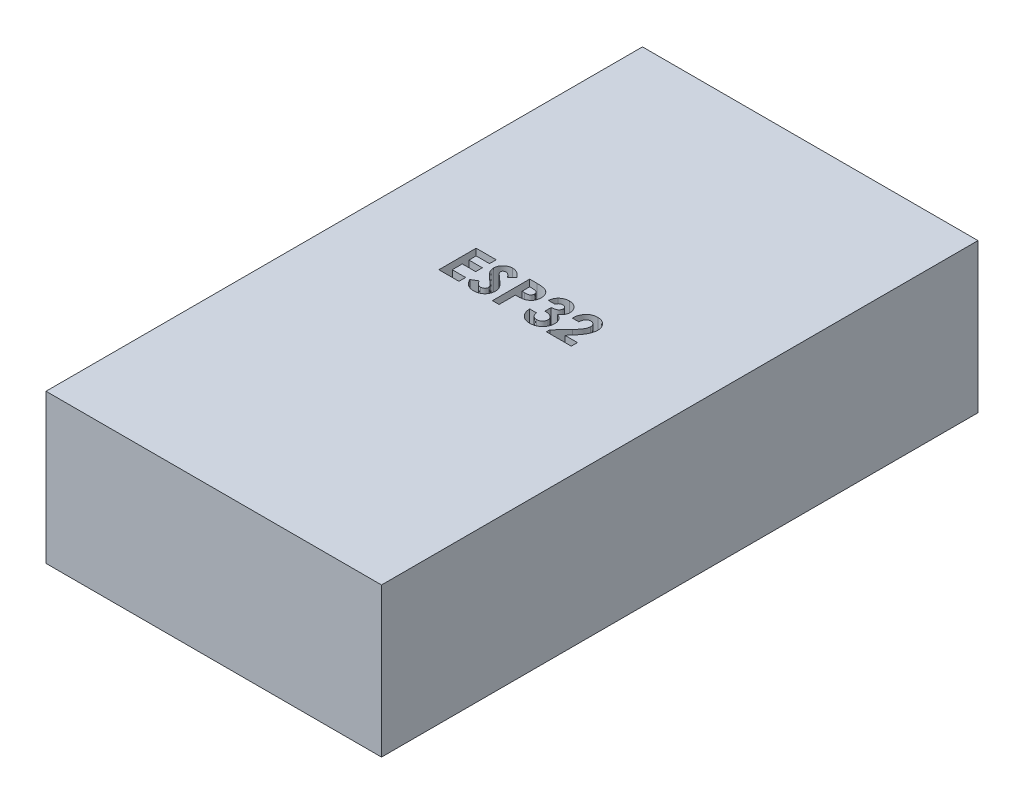
from build123d import *

# Parameters (mm, degrees)
SKETCH1_W           = 28.575
SKETCH1_H           = 50.8
BOSS_EXTRUDE1_DEPTH = 12.7
CUT_EXTRUDE1_DEPTH  = 2.54


with BuildPart() as part:
    # Sketch1 → Boss-Extrude1 (new body)
    with BuildSketch(Plane(origin=(0, 0, 0), x_dir=(1, 0, 0), z_dir=(0, 1, 0))):
        Rectangle(SKETCH1_W, SKETCH1_H)
    extrude(amount=BOSS_EXTRUDE1_DEPTH)

    # Sketch3 → Cut-Extrude1 (cut)
    # profile 1 of 5: a face of its own
    with BuildSketch(Plane(origin=(0, 12.7, 0), x_dir=(1, 0, 0), z_dir=(0, 1, 0))):
        Polygon((-6.520214161, 3.467267812), (-4.810598776, 3.467267812), (-4.810598776, 2.897396017), (-5.950342366, 2.897396017), (-5.950342366, 2.286819094), (-4.810598776, 2.286819094), (-4.810598776, 1.716947299), (-5.950342366, 1.716947299), (-5.950342366, 0.862139607), (-4.810598776, 0.862139607), (-4.810598776, 0.292267812), (-6.520214161, 0.292267812), align=None)
    # profile 2 of 5: a face of its own
    with BuildSketch(Plane(origin=(0, 12.7, 0), x_dir=(1, 0, 0), z_dir=(0, 1, 0))):
        with BuildLine():
            Line((-2.612521853, 3.043044054), (-3.038653664, 2.653165248))
            add(Edge.make_bspline(
                [(-3.038653664, 2.653165248), (-3.056907324, 2.678913932), (-3.091951804, 2.728347816), (-3.148755253, 2.794540951), (-3.205302204, 2.851008621), (-3.262116532, 2.89751493), (-3.319701817, 2.933777319), (-3.377958099, 2.959451491), (-3.436555108, 2.975772805), (-3.475923252, 2.977805202), (-3.495314321, 2.978806273)],
                knots=[0, 0, 0, 0, 1.299362458, 2.494594718, 3.587462134, 4.587049575, 5.512617175, 6.380583204, 7.202344345, 8, 8, 8, 8], degree=3))
            add(Edge.make_bspline(
                [(-3.495314321, 2.978806273), (-3.513401754, 2.978171948), (-3.548323835, 2.976947233), (-3.598107853, 2.964773658), (-3.642306812, 2.943763856), (-3.680877578, 2.916291771), (-3.711431315, 2.883194279), (-3.735826105, 2.848483519), (-3.749562421, 2.81017069), (-3.751370391, 2.783855894), (-3.752265443, 2.770828509)],
                knots=[0, 0, 0, 0, 1.185010067, 2.2879431, 3.333075148, 4.379039566, 5.372662701, 6.27520591, 7.14612461, 8, 8, 8, 8], degree=3))
            add(Edge.make_bspline(
                [(-3.752265443, 2.770828509), (-3.751704559, 2.757613263), (-3.750575017, 2.730999594), (-3.739665178, 2.691993949), (-3.723220936, 2.653880892), (-3.707507792, 2.630679661), (-3.69947598, 2.618820296)],
                knots=[0, 0, 0, 0, 0.967525499, 1.948461899, 2.951351359, 4, 4, 4, 4], degree=3))
            add(Edge.make_bspline(
                [(-3.69947598, 2.618820296), (-3.692174194, 2.609602135), (-3.675366448, 2.588383147), (-3.643317518, 2.554775578), (-3.603070792, 2.513603364), (-3.553077493, 2.466282297), (-3.495412979, 2.411110526), (-3.427404426, 2.350256875), (-3.351009416, 2.281836777), (-3.296709613, 2.234191498), (-3.268256028, 2.209224943)],
                knots=[0, 0, 0, 0, 0.473873513, 1.090794244, 1.870441696, 2.795289791, 3.865433203, 5.087734844, 6.473946851, 8, 8, 8, 8], degree=3))
            add(Edge.make_bspline(
                [(-3.268256028, 2.209224943), (-3.241548245, 2.186110704), (-3.190862422, 2.142244681), (-3.11874656, 2.079983904), (-3.055368729, 2.023969401), (-2.999805658, 1.975041829), (-2.952899628, 1.932687828), (-2.914453446, 1.896704944), (-2.883997558, 1.8677937), (-2.866685169, 1.85033129), (-2.859296693, 1.842878789)],
                knots=[0, 0, 0, 0, 1.543621617, 2.929473131, 4.163658386, 5.240097082, 6.164993805, 6.925417477, 7.541396219, 8, 8, 8, 8], degree=3))
            add(Edge.make_bspline(
                [(-2.859296693, 1.842878789), (-2.831266356, 1.812543961), (-2.777382203, 1.754229768), (-2.707351801, 1.663861108), (-2.649714514, 1.57564287), (-2.605125217, 1.487915084), (-2.571449586, 1.399412012), (-2.54770782, 1.307963122), (-2.533488718, 1.21261283), (-2.531910066, 1.147547896), (-2.531111597, 1.114638605)],
                knots=[0, 0, 0, 0, 1.206664779, 2.319633467, 3.337109185, 4.282041471, 5.190008762, 6.099243693, 7.03861361, 8, 8, 8, 8], degree=3))
            add(Edge.make_bspline(
                [(-2.531111597, 1.114638605), (-2.531679926, 1.082572537), (-2.532795011, 1.019657718), (-2.546452652, 0.927591252), (-2.565927647, 0.839479649), (-2.596039406, 0.756281686), (-2.632739439, 0.676631695), (-2.678748231, 0.60177037), (-2.732779249, 0.530940084), (-2.794707091, 0.465407013), (-2.863206638, 0.405940294), (-2.936678913, 0.353001616), (-3.015842364, 0.309293994), (-3.10002063, 0.273303885), (-3.189168654, 0.245583822), (-3.283180234, 0.225096112), (-3.382199165, 0.212799711), (-3.449909738, 0.211514268), (-3.484502021, 0.210857555)],
                knots=[0, 0, 0, 0, 1.043214005, 2.046824704, 3.02475056, 3.976699089, 4.921714032, 5.875962561, 6.831408892, 7.817874052, 8.806269674, 9.781291748, 10.760897367, 11.74438705, 12.757449933, 13.795994037, 14.874007457, 16, 16, 16, 16], degree=3))
            add(Edge.make_bspline(
                [(-3.484502021, 0.210857555), (-3.51165667, 0.211339297), (-3.565438446, 0.212293421), (-3.644704654, 0.220083054), (-3.721245138, 0.232654693), (-3.794973682, 0.250673606), (-3.866222447, 0.273506013), (-3.934994359, 0.301394924), (-4.000814661, 0.334772605), (-4.064181383, 0.37295268), (-4.124786483, 0.417284777), (-4.183396289, 0.466862539), (-4.239428633, 0.522448496), (-4.293152626, 0.583911189), (-4.344224528, 0.651424664), (-4.394316106, 0.724048673), (-4.441201138, 0.803131018), (-4.470164108, 0.858607923), (-4.484957751, 0.886944294)],
                knots=[0, 0, 0, 0, 1.016823716, 2.013894106, 2.979844003, 3.91962641, 4.853723003, 5.779685073, 6.695824784, 7.614987388, 8.547259901, 9.504950863, 10.487499108, 11.500346958, 12.559593716, 13.656357062, 14.802919212, 16, 16, 16, 16], degree=3))
            Line((-4.484957751, 0.886944294), (-3.98377586, 1.187780632))
            add(Edge.make_bspline(
                [(-3.98377586, 1.187780632), (-3.965271224, 1.155615148), (-3.929796257, 1.093951167), (-3.869680608, 1.011097792), (-3.808095195, 0.940147591), (-3.743616217, 0.882354613), (-3.677027716, 0.836946093), (-3.608008054, 0.804494014), (-3.536508737, 0.784406214), (-3.487806651, 0.781953029), (-3.46351344, 0.78072935)],
                knots=[0, 0, 0, 0, 1.283663364, 2.460892379, 3.537111102, 4.529833553, 5.449777664, 6.316464042, 7.160231139, 8, 8, 8, 8], degree=3))
            add(Edge.make_bspline(
                [(-3.46351344, 0.78072935), (-3.438803765, 0.781728673), (-3.390863399, 0.783667505), (-3.32243466, 0.801575908), (-3.259696601, 0.829693415), (-3.205466287, 0.869813221), (-3.159547475, 0.916117574), (-3.125656757, 0.967633284), (-3.104366379, 1.023372039), (-3.10211547, 1.062091845), (-3.100983392, 1.081565688)],
                knots=[0, 0, 0, 0, 1.13588714, 2.203786484, 3.234766741, 4.283437687, 5.291419208, 6.222934724, 7.106237994, 8, 8, 8, 8], degree=3))
            add(Edge.make_bspline(
                [(-3.100983392, 1.081565688), (-3.10202882, 1.099682931), (-3.104152506, 1.136486374), (-3.119794929, 1.191207177), (-3.144248808, 1.245903093), (-3.17317947, 1.290766164), (-3.202620042, 1.328328797), (-3.230771868, 1.360875119), (-3.265053346, 1.396833107), (-3.305377553, 1.436247994), (-3.351211699, 1.479466758), (-3.402594396, 1.526485168), (-3.460114029, 1.576889048), (-3.500769019, 1.611223672), (-3.522027061, 1.629176866)],
                knots=[0, 0, 0, 0, 0.916159276, 1.861089862, 2.860218735, 3.940849679, 4.552606315, 5.27541173, 6.11797699, 7.06649574, 8.129236253, 9.306560635, 10.591630461, 12, 12, 12, 12], degree=3))
            add(Edge.make_bspline(
                [(-3.522027061, 1.629176866), (-3.562439447, 1.66336962), (-3.640003047, 1.728995863), (-3.749610254, 1.825923758), (-3.848376161, 1.916511757), (-3.935447721, 2.001879727), (-4.01193436, 2.080451118), (-4.077318076, 2.152864117), (-4.1308806, 2.219677292), (-4.187243607, 2.298813026), (-4.240799732, 2.395245356), (-4.287087423, 2.511264628), (-4.317116923, 2.627269179), (-4.320481311, 2.705148245), (-4.322137238, 2.743479751)],
                knots=[0, 0, 0, 0, 1.345494975, 2.582412109, 3.71882943, 4.751509156, 5.681369928, 6.505683931, 7.230279997, 7.856715994, 8.973648664, 10.023341002, 11.027102913, 12, 12, 12, 12], degree=3))
            add(Edge.make_bspline(
                [(-4.322137238, 2.743479751), (-4.32144854, 2.770662398), (-4.320091731, 2.824215132), (-4.307988788, 2.902956624), (-4.289900478, 2.978935548), (-4.263631059, 3.051874698), (-4.229536525, 3.121682715), (-4.188130038, 3.188701338), (-4.138768633, 3.252313743), (-4.083141662, 3.31247776), (-4.021854982, 3.367460824), (-3.956362377, 3.415988888), (-3.887034539, 3.456976396), (-3.814295582, 3.49097851), (-3.737694772, 3.517004969), (-3.657796425, 3.53545382), (-3.57448594, 3.546426608), (-3.517819947, 3.547918231), (-3.488954145, 3.548678068)],
                knots=[0, 0, 0, 0, 1.010766082, 1.991317756, 2.957454644, 3.913069143, 4.869106762, 5.843196583, 6.838735724, 7.860187025, 8.887984031, 9.89767229, 10.887916223, 11.879572884, 12.879850636, 13.892031539, 14.926195476, 16, 16, 16, 16], degree=3))
            add(Edge.make_bspline(
                [(-3.488954145, 3.548678068), (-3.451545494, 3.54730958), (-3.377023484, 3.544583406), (-3.266840542, 3.523265617), (-3.159218451, 3.489741148), (-3.072494553, 3.449297564), (-3.003489966, 3.410119846), (-2.950604396, 3.374049938), (-2.896790482, 3.332729919), (-2.841614249, 3.286029581), (-2.786100955, 3.233069025), (-2.728672092, 3.175109022), (-2.6701102, 3.11164866), (-2.632054255, 3.066312871), (-2.612521853, 3.043044054)],
                knots=[0, 0, 0, 0, 1.282922637, 2.555718331, 3.837320111, 5.142675274, 5.830281639, 6.55870424, 7.337177975, 8.157850921, 9.037902056, 9.96903443, 10.957596896, 12, 12, 12, 12], degree=3))
        make_face()
    # profile 3 of 5: a face of its own
    with BuildSketch(Plane(origin=(0, 12.7, 0), x_dir=(1, 0, 0), z_dir=(0, 1, 0))):
        with BuildLine():
            Line((-1.961239802, 3.467267812), (-1.325222174, 3.467267812))
            add(Edge.make_bspline(
                [(-1.325222174, 3.467267812), (-1.283665607, 3.467081796), (-1.203494279, 3.466722932), (-1.087880628, 3.462371229), (-0.981221374, 3.454572713), (-0.883541022, 3.444934981), (-0.794879736, 3.431423255), (-0.715126485, 3.415933119), (-0.644264719, 3.397061626), (-0.581495365, 3.374661424), (-0.525161898, 3.348252462), (-0.471852269, 3.320125032), (-0.422771281, 3.286555937), (-0.375441669, 3.25116311), (-0.332569348, 3.210565489), (-0.291479687, 3.167464905), (-0.253912944, 3.120152023), (-0.219695049, 3.069199553), (-0.188654147, 3.01554888), (-0.161534737, 2.959104091), (-0.139536991, 2.899775868), (-0.121083617, 2.837947999), (-0.106261688, 2.773623177), (-0.096395739, 2.706405798), (-0.089694291, 2.636765201), (-0.089102981, 2.589367767), (-0.088803904, 2.565394815)],
                knots=[0, 0, 0, 0, 1.698747864, 3.27724071, 4.728299578, 6.070144658, 7.288476769, 8.393259625, 9.389771311, 10.283485332, 11.113357557, 11.931608583, 12.74405601, 13.541433047, 14.344816069, 15.154114104, 15.974336324, 16.810834471, 17.661136416, 18.50621059, 19.367396281, 20.244825668, 21.142564693, 22.063065223, 23.020325768, 24, 24, 24, 24], degree=3))
            add(Edge.make_bspline(
                [(-0.088803904, 2.565394815), (-0.089236631, 2.538874109), (-0.09008699, 2.486757662), (-0.098423258, 2.410361345), (-0.112664237, 2.337524373), (-0.131276451, 2.2676325), (-0.157229861, 2.201835601), (-0.186880412, 2.138563743), (-0.223359996, 2.079590873), (-0.265043751, 2.024179314), (-0.310567168, 1.971878541), (-0.36101097, 1.924198642), (-0.415413676, 1.880814584), (-0.473460368, 1.841271699), (-0.535368972, 1.805649754), (-0.601094818, 1.773615186), (-0.671086717, 1.746192561), (-0.719826971, 1.73185075), (-0.744538079, 1.72457951)],
                knots=[0, 0, 0, 0, 1.102006807, 2.165578795, 3.188629044, 4.184801286, 5.166646146, 6.124351954, 7.085497154, 8.042432466, 9.003981491, 9.963833307, 10.922997304, 11.89326795, 12.880200226, 13.889073926, 14.929769137, 16, 16, 16, 16], degree=3))
            add(Edge.make_bspline(
                [(-0.744538079, 1.72457951), (-0.760814237, 1.720529976), (-0.796073635, 1.711757381), (-0.854418255, 1.702850995), (-0.921654304, 1.69466212), (-0.997999199, 1.687624774), (-1.083496956, 1.682841018), (-1.17806479, 1.679105118), (-1.281745558, 1.676388732), (-1.353841064, 1.676292343), (-1.391368007, 1.676242171)],
                knots=[0, 0, 0, 0, 0.618981996, 1.340914327, 2.176866532, 3.120127938, 4.170906482, 5.338178032, 6.614476169, 8, 8, 8, 8], degree=3))
            Line((-1.391368007, 1.676242171), (-1.391368007, 0.292267812))
            Line((-1.391368007, 0.292267812), (-1.961239802, 0.292267812))
            Line((-1.961239802, 0.292267812), (-1.961239802, 3.467267812))
        make_face()
        with BuildLine():
            Line((-1.391368007, 2.246113966), (-1.189750419, 2.246113966))
            add(Edge.make_bspline(
                [(-1.189750419, 2.246113966), (-1.153062916, 2.246346593), (-1.085557365, 2.24677463), (-0.99336862, 2.252964303), (-0.919283972, 2.262417183), (-0.860755724, 2.275974799), (-0.814542129, 2.296550276), (-0.774685796, 2.320352229), (-0.740500002, 2.350449145), (-0.710900136, 2.384840021), (-0.687235936, 2.424356861), (-0.670826045, 2.468356211), (-0.660166503, 2.515913596), (-0.659181995, 2.549010389), (-0.658675699, 2.566030833)],
                knots=[0, 0, 0, 0, 1.8619151, 3.425951444, 4.686033666, 5.651700536, 6.461346321, 7.243864085, 7.999046032, 8.762387399, 9.539336099, 10.322741239, 11.137448474, 12, 12, 12, 12], degree=3))
            add(Edge.make_bspline(
                [(-0.658675699, 2.566030833), (-0.659176787, 2.580901373), (-0.660149017, 2.609753796), (-0.667291287, 2.651395), (-0.67867401, 2.690213192), (-0.695167138, 2.725802968), (-0.716488848, 2.758103855), (-0.742484327, 2.787103128), (-0.772820002, 2.813421832), (-0.796240916, 2.827352724), (-0.808139842, 2.834430272)],
                knots=[0, 0, 0, 0, 1.102301479, 2.1387299, 3.123554645, 4.094223062, 5.036071848, 5.982632524, 6.975082478, 8, 8, 8, 8], degree=3))
            add(Edge.make_bspline(
                [(-0.808139842, 2.834430272), (-0.818218919, 2.83952755), (-0.83955839, 2.850319532), (-0.875901579, 2.862866001), (-0.917841063, 2.87345033), (-0.965659983, 2.88223522), (-1.019167574, 2.889053208), (-1.07835429, 2.894267262), (-1.143307229, 2.896364037), (-1.188478112, 2.897042536), (-1.212011036, 2.897396017)],
                knots=[0, 0, 0, 0, 0.656809284, 1.390599849, 2.23162475, 3.173112763, 4.218524733, 5.370385145, 6.63003504, 8, 8, 8, 8], degree=3))
            Line((-1.212011036, 2.897396017), (-1.391368007, 2.897396017))
            Line((-1.391368007, 2.897396017), (-1.391368007, 2.246113966))
        make_face(mode=Mode.SUBTRACT)
    # profile 4 of 5: a face of its own
    with BuildSketch(Plane(origin=(0, 12.7, 0), x_dir=(1, 0, 0), z_dir=(0, 1, 0))):
        with BuildLine():
            Line((0.969529429, 2.693870376), (0.399657634, 2.693870376))
            add(Edge.make_bspline(
                [(0.399657634, 2.693870376), (0.403681146, 2.722356234), (0.411568974, 2.778200872), (0.430443491, 2.859049995), (0.453019451, 2.935740922), (0.481204383, 3.008030788), (0.514260723, 3.076048365), (0.551852325, 3.140027056), (0.594385568, 3.199692252), (0.62698775, 3.235634803), (0.643252386, 3.253565889)],
                knots=[0, 0, 0, 0, 1.111473889, 2.178970933, 3.205615836, 4.199322666, 5.174200091, 6.12565194, 7.064921805, 8, 8, 8, 8], degree=3))
            add(Edge.make_bspline(
                [(0.643252386, 3.253565889), (0.666711968, 3.277224657), (0.712948339, 3.323853603), (0.790214738, 3.383580132), (0.871204194, 3.435269381), (0.957540985, 3.476248992), (1.047881646, 3.509417239), (1.142944598, 3.531696426), (1.242341377, 3.546478863), (1.310167175, 3.547934985), (1.34477983, 3.548678068)],
                knots=[0, 0, 0, 0, 1.01925491, 2.00884431, 2.983262333, 3.955970413, 4.92937149, 5.924503185, 6.940838805, 8, 8, 8, 8], degree=3))
            add(Edge.make_bspline(
                [(1.34477983, 3.548678068), (1.37555226, 3.547951591), (1.436044657, 3.546523484), (1.52495326, 3.535059417), (1.609720173, 3.514952718), (1.691241406, 3.488663662), (1.768318048, 3.452893007), (1.842651255, 3.411370889), (1.912164154, 3.360442287), (1.977019393, 3.302898092), (2.0366013, 3.240658411), (2.088199492, 3.174129312), (2.132559383, 3.105087938), (2.169106067, 3.032960687), (2.1972055, 2.957625511), (2.216707339, 2.879517612), (2.229471767, 2.798809339), (2.230743438, 2.743953013), (2.231388403, 2.716130993)],
                knots=[0, 0, 0, 0, 1.091422571, 2.145516843, 3.172569842, 4.178562979, 5.178154469, 6.181868002, 7.194278174, 8.227918432, 9.254613415, 10.245994977, 11.209837596, 12.161663635, 13.10878368, 14.055455738, 15.013766427, 16, 16, 16, 16], degree=3))
            add(Edge.make_bspline(
                [(2.231388403, 2.716130993), (2.230064895, 2.681675737), (2.227459315, 2.613843932), (2.206078642, 2.514567046), (2.172612076, 2.419640626), (2.124266365, 2.330392836), (2.063821914, 2.247066557), (1.989658596, 2.172447639), (1.903888776, 2.105366156), (1.839500229, 2.06931656), (1.806528628, 2.050856554)],
                knots=[0, 0, 0, 0, 0.992805628, 1.954529043, 2.915727527, 3.886831945, 4.871318353, 5.87440735, 6.911542536, 8, 8, 8, 8], degree=3))
            add(Edge.make_bspline(
                [(1.806528628, 2.050856554), (1.829159829, 2.043426254), (1.873629125, 2.028826048), (1.936836882, 2.000071107), (1.996940237, 1.968646723), (2.052904231, 1.932139872), (2.105285493, 1.89202673), (2.153764702, 1.847964396), (2.198631509, 1.800048944), (2.239153482, 1.74801686), (2.275118316, 1.692700294), (2.307387647, 1.635377027), (2.333947105, 1.575177741), (2.356446272, 1.512789952), (2.373575857, 1.447652951), (2.385636616, 1.38001914), (2.392608031, 1.310042795), (2.39367129, 1.262633864), (2.394208916, 1.238662043)],
                knots=[0, 0, 0, 0, 1.059543567, 2.081955587, 3.086750234, 4.076226789, 5.052108497, 6.020845489, 6.989030705, 7.970690546, 8.952259656, 9.923888338, 10.895517021, 11.877585046, 12.873342345, 13.889638361, 14.932918083, 16, 16, 16, 16], degree=3))
            add(Edge.make_bspline(
                [(2.394208916, 1.238662043), (2.393119076, 1.203433197), (2.390970134, 1.133969089), (2.377308163, 1.031655567), (2.351872036, 0.934108714), (2.318409402, 0.840206106), (2.27377388, 0.751159991), (2.221245374, 0.664926883), (2.156677286, 0.584497323), (2.084920944, 0.50774496), (2.005231342, 0.437965149), (1.918834849, 0.377469192), (1.827631251, 0.325552898), (1.731043527, 0.283405772), (1.629105234, 0.250947664), (1.522043585, 0.227485447), (1.409408735, 0.213130875), (1.332526637, 0.21162607), (1.293262402, 0.210857555)],
                knots=[0, 0, 0, 0, 1.005138573, 1.981928558, 2.936866704, 3.876260664, 4.820238198, 5.773547, 6.751179199, 7.756627054, 8.768222608, 9.766606018, 10.760583154, 11.757261445, 12.767156078, 13.807575856, 14.880313354, 16, 16, 16, 16], degree=3))
            add(Edge.make_bspline(
                [(1.293262402, 0.210857555), (1.256119068, 0.211667824), (1.183490194, 0.213252197), (1.077255266, 0.226965749), (0.976289022, 0.249086821), (0.880333796, 0.280268306), (0.78976083, 0.320705364), (0.703748773, 0.368856826), (0.624013978, 0.427499958), (0.549668041, 0.493987497), (0.48236018, 0.56858274), (0.422202803, 0.649557727), (0.37052239, 0.737220371), (0.327107, 0.831196142), (0.292296043, 0.9316499), (0.264837262, 1.038377368), (0.245656854, 1.151587059), (0.23981542, 1.229477735), (0.236837121, 1.269190889)],
                knots=[0, 0, 0, 0, 1.066544725, 2.085487077, 3.070979577, 4.031932826, 4.977951092, 5.916076795, 6.857635327, 7.814973522, 8.776389752, 9.738577119, 10.707772778, 11.69409279, 12.707140348, 13.757286496, 14.856535458, 16, 16, 16, 16], degree=3))
            Line((0.236837121, 1.269190889), (0.806708916, 1.269190889))
            add(Edge.make_bspline(
                [(0.806708916, 1.269190889), (0.810320134, 1.249222594), (0.817353929, 1.210329103), (0.831072913, 1.154019974), (0.848950664, 1.10204317), (0.869621792, 1.053936723), (0.891949722, 1.009069011), (0.918927201, 0.969097111), (0.948577461, 0.932935621), (0.991363002, 0.889946443), (1.05252788, 0.845776857), (1.13512073, 0.807391386), (1.226997453, 0.784892784), (1.291228445, 0.782148024), (1.324427265, 0.78072935)],
                knots=[0, 0, 0, 0, 0.928156231, 1.807827665, 2.648129825, 3.438902246, 4.202261636, 4.936546065, 5.639352463, 6.338805438, 7.70633318, 9.064371875, 10.482673459, 12, 12, 12, 12], degree=3))
            add(Edge.make_bspline(
                [(1.324427265, 0.78072935), (1.342043733, 0.781031443), (1.376550451, 0.781623176), (1.427235682, 0.788181743), (1.475520502, 0.798983708), (1.521494842, 0.813663177), (1.565451379, 0.83206481), (1.606550279, 0.855792615), (1.64562924, 0.883379575), (1.682263438, 0.914394642), (1.716114192, 0.948189962), (1.74428001, 0.985612537), (1.77002153, 1.023640562), (1.789060144, 1.064761965), (1.805742071, 1.106763974), (1.815952262, 1.151171131), (1.82366169, 1.197051892), (1.824109731, 1.228450672), (1.824337121, 1.244386201)],
                knots=[0, 0, 0, 0, 1.110435564, 2.175094844, 3.216326037, 4.226890168, 5.215276772, 6.21526065, 7.213097102, 8.228249917, 9.239874822, 10.221364777, 11.178138315, 12.128914389, 13.072518965, 14.022636769, 14.996447288, 16, 16, 16, 16], degree=3))
            add(Edge.make_bspline(
                [(1.824337121, 1.244386201), (1.823733443, 1.261814418), (1.822531658, 1.296510003), (1.812712951, 1.347140915), (1.797207138, 1.395843771), (1.775667668, 1.442402893), (1.746904108, 1.486646673), (1.712963427, 1.529462775), (1.671171662, 1.568622698), (1.625320499, 1.607331094), (1.572151163, 1.641073142), (1.514253074, 1.672212093), (1.450104581, 1.696989086), (1.381271607, 1.719119529), (1.306452111, 1.735283261), (1.226110694, 1.747019706), (1.140376959, 1.755755671), (1.081279582, 1.757008988), (1.050939685, 1.757652427)],
                knots=[0, 0, 0, 0, 0.809814727, 1.612155564, 2.388397, 3.182215007, 3.988903953, 4.837162975, 5.715530372, 6.646997145, 7.623086902, 8.637258368, 9.698941581, 10.815059213, 11.996518529, 13.252603015, 14.589518788, 16, 16, 16, 16], degree=3))
            Line((1.050939685, 1.757652427), (1.050939685, 2.286819094))
            add(Edge.make_bspline(
                [(1.050939685, 2.286819094), (1.088714661, 2.290036132), (1.15938416, 2.296054572), (1.257477214, 2.310128905), (1.34005892, 2.328941568), (1.409114132, 2.351638027), (1.466453155, 2.380786194), (1.516544209, 2.412964483), (1.559684995, 2.450334864), (1.596144745, 2.491782955), (1.625311411, 2.536294319), (1.645953879, 2.583177116), (1.659585085, 2.630980735), (1.660876641, 2.66367697), (1.661516608, 2.679877988)],
                knots=[0, 0, 0, 0, 1.70044513, 3.18119609, 4.440695891, 5.496282586, 6.431922213, 7.318171381, 8.16090191, 8.983045123, 9.787564368, 10.536848927, 11.275007137, 12, 12, 12, 12], degree=3))
            add(Edge.make_bspline(
                [(1.661516608, 2.679877988), (1.660412482, 2.700548728), (1.65825746, 2.740893636), (1.641520396, 2.798635698), (1.612466748, 2.850107961), (1.573510909, 2.895202112), (1.526041864, 2.932868126), (1.470399822, 2.960213011), (1.407792218, 2.976279351), (1.363744395, 2.97794489), (1.340963724, 2.978806273)],
                knots=[0, 0, 0, 0, 1.009664648, 1.970651636, 2.907870547, 3.878035693, 4.867062054, 5.849714035, 6.887914197, 8, 8, 8, 8], degree=3))
            add(Edge.make_bspline(
                [(1.340963724, 2.978806273), (1.320315606, 2.977789931), (1.279343417, 2.975773197), (1.219429813, 2.960720827), (1.162531851, 2.935382035), (1.109827725, 2.900441334), (1.062078232, 2.858479033), (1.022889675, 2.808783398), (0.990294491, 2.754331781), (0.976478251, 2.714103186), (0.969529429, 2.693870376)],
                knots=[0, 0, 0, 0, 0.98818071, 1.960853194, 2.938124878, 3.957524365, 4.978590984, 5.968022688, 6.978025184, 8, 8, 8, 8], degree=3))
        make_face()
    # profile 5 of 5: a face of its own
    with BuildSketch(Plane(origin=(0, 12.7, 0), x_dir=(1, 0, 0), z_dir=(0, 1, 0))):
        with BuildLine():
            Line((3.289721737, 2.408934478), (2.719849942, 2.408934478))
            add(Edge.make_bspline(
                [(2.719849942, 2.408934478), (2.722311131, 2.452042265), (2.727120146, 2.536272291), (2.746249193, 2.658619102), (2.77188146, 2.774223384), (2.806091124, 2.882680741), (2.849077804, 2.983951764), (2.899735343, 3.078381691), (2.959357926, 3.165473345), (3.026676588, 3.244806723), (3.100548444, 3.315977428), (3.179439841, 3.379081846), (3.26455753, 3.431154024), (3.354346341, 3.474004606), (3.448790984, 3.508240229), (3.548785055, 3.531129514), (3.65346275, 3.546630362), (3.725123109, 3.547986748), (3.761646817, 3.548678068)],
                knots=[0, 0, 0, 0, 1.199038563, 2.342849363, 3.436047546, 4.486744587, 5.497670872, 6.488682221, 7.459191391, 8.424610317, 9.374430501, 10.305433194, 11.225809216, 12.140057399, 13.06607119, 14.010487599, 14.985989317, 16, 16, 16, 16], degree=3))
            add(Edge.make_bspline(
                [(3.761646817, 3.548678068), (3.80647915, 3.547279181), (3.89400237, 3.544548226), (4.021180552, 3.521252272), (4.139951068, 3.482286188), (4.250227585, 3.427840293), (4.351071297, 3.358672491), (4.442465484, 3.276201207), (4.521646238, 3.17869615), (4.589115589, 3.070214347), (4.645174556, 2.955347385), (4.684458346, 2.836570183), (4.710279157, 2.717034607), (4.713033107, 2.6365454), (4.714401224, 2.596559679)],
                knots=[0, 0, 0, 0, 1.075374347, 2.099382735, 3.09057751, 4.06680945, 5.040638231, 6.016817125, 7.011024321, 8.044445721, 9.0776792, 10.070479129, 11.0414456, 12, 12, 12, 12], degree=3))
            add(Edge.make_bspline(
                [(4.714401224, 2.596559679), (4.713868551, 2.572373489), (4.712796413, 2.523692662), (4.705341694, 2.450026623), (4.694158142, 2.37498915), (4.677296071, 2.298644581), (4.656267686, 2.220971514), (4.630757216, 2.141737501), (4.60017292, 2.061391769), (4.565025188, 1.979030042), (4.523093855, 1.894384923), (4.474270645, 1.806187549), (4.417259681, 1.714516157), (4.352749584, 1.618853141), (4.280427042, 1.519349377), (4.199939001, 1.416304601), (4.112212495, 1.309355716), (4.049950526, 1.237866388), (4.017961921, 1.201137002)],
                knots=[0, 0, 0, 0, 0.728284026, 1.46585585, 2.227944881, 3.01186502, 3.81876927, 4.650621989, 5.517437689, 6.406905708, 7.346299482, 8.360816762, 9.441613733, 10.596154504, 11.834900912, 13.145207542, 14.533280747, 16, 16, 16, 16], degree=3))
            Line((4.017961921, 1.201137002), (3.686596737, 0.821434478))
            Line((3.686596737, 0.821434478), (4.755106352, 0.821434478))
            Line((4.755106352, 0.821434478), (4.755106352, 0.292267812))
            Line((4.755106352, 0.292267812), (2.638439685, 0.292267812))
            Line((2.638439685, 0.292267812), (2.638439685, 0.581019815))
            Line((2.638439685, 0.581019815), (3.57847374, 1.581475544))
            add(Edge.make_bspline(
                [(3.57847374, 1.581475544), (3.605690141, 1.610659148), (3.65840024, 1.667179135), (3.733401278, 1.750184749), (3.801270593, 1.828955096), (3.860600858, 1.904328919), (3.91450565, 1.973861401), (3.960581358, 2.039648336), (3.999249539, 2.101094986), (4.041229334, 2.175188915), (4.081096339, 2.26355911), (4.117676729, 2.365365198), (4.139975008, 2.462668372), (4.143052876, 2.526073212), (4.144529429, 2.556490568)],
                knots=[0, 0, 0, 0, 1.246127091, 2.413378631, 3.493388633, 4.492180848, 5.408488754, 6.240484944, 6.999099869, 7.674939598, 8.898438119, 10.020720584, 11.050475521, 12, 12, 12, 12], degree=3))
            add(Edge.make_bspline(
                [(4.144529429, 2.556490568), (4.143425446, 2.585917014), (4.141286302, 2.64293547), (4.117778844, 2.72404392), (4.081360275, 2.797479343), (4.030041367, 2.861047403), (3.967878097, 2.913285494), (3.896042599, 2.952138718), (3.815120544, 2.97455685), (3.758392642, 2.977362799), (3.729209918, 2.978806273)],
                knots=[0, 0, 0, 0, 1.062038974, 2.057870785, 3.028805853, 4.01125022, 4.991535629, 5.949134679, 6.94496649, 8, 8, 8, 8], degree=3))
            add(Edge.make_bspline(
                [(3.729209918, 2.978806273), (3.71413375, 2.978273037), (3.684453894, 2.977223275), (3.640826825, 2.970235295), (3.599312535, 2.95791971), (3.559448945, 2.941418559), (3.521661492, 2.919546165), (3.486045487, 2.892584955), (3.45222567, 2.861220074), (3.420357153, 2.825549596), (3.391352642, 2.785741332), (3.365590942, 2.742158849), (3.344290304, 2.694829201), (3.325536448, 2.64437721), (3.311072577, 2.590260982), (3.300541085, 2.532804395), (3.292534695, 2.472100925), (3.290676447, 2.430372997), (3.289721737, 2.408934478)],
                knots=[0, 0, 0, 0, 0.903469896, 1.778625579, 2.63899355, 3.493148037, 4.358286772, 5.247621495, 6.164656832, 7.118446693, 8.109501108, 9.111810964, 10.146451449, 11.215617525, 12.33435995, 13.498009769, 14.714554818, 16, 16, 16, 16], degree=3))
        make_face()
    extrude(amount=-CUT_EXTRUDE1_DEPTH, mode=Mode.SUBTRACT)


solid = part.part
